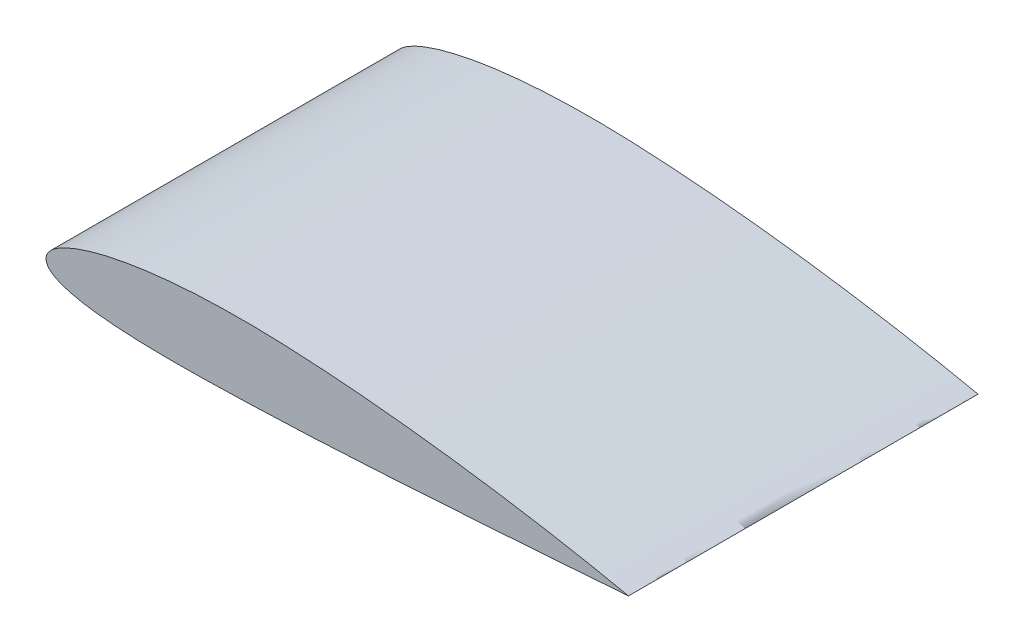
from build123d import *

# Parameters (mm, degrees)
BOSS_EXTRUDE1_DEPTH = 90


with BuildPart() as part:
    # Sketch2 → Boss-Extrude1 (new body)
    with BuildSketch(Plane(origin=(0, 0, 0), x_dir=(0, 1, 0), z_dir=(0, 0, 1))):
        with BuildLine():
            add(Edge.make_bspline(
                [(0, -150), (0.001772852, -150.000113217), (0.014188067, -149.921239361), (0.03587152, -149.840387792), (0.075849773, -149.640781801), (0.129807126, -149.392078651), (0.199990784, -149.060600085), (0.284481374, -148.660424171), (0.384371921, -148.186888977), (0.498346945, -147.642080423), (0.626809917, -147.026096757), (0.768724972, -146.339540429), (0.924267178, -145.583125546), (1.092662171, -144.757444861), (1.273444565, -143.863349902), (1.466386397, -142.901656771), (1.670374758, -141.873202247), (1.885284333, -140.779031297), (2.110311722, -139.620134055), (2.34521269, -138.39763873), (2.588824588, -137.112596551), (2.840744875, -135.766314996), (3.100300174, -134.360029922), (3.366895678, -132.895101478), (3.63983625, -131.37288001), (3.91827985, -129.794898901), (4.201492493, -128.162544552), (4.489134212, -126.47752869), (4.780158908, -124.741283385), (5.074098064, -122.955664154), (5.36989332, -121.122204321), (5.667296066, -119.242834729), (5.965203364, -117.319233153), (6.263182835, -115.353399457), (6.56036872, -113.347150514), (6.856214891, -111.302509581), (7.150030783, -109.221376762), (7.440876589, -107.105819136), (7.728379981, -104.957931758), (8.011628833, -102.779829054), (8.290127231, -100.573637671), (8.563045044, -98.34143452), (8.829802629, -96.085479086), (9.08986205, -93.80803378), (9.342454999, -91.511339391), (9.586687785, -89.197670733), (9.822305905, -86.869265226), (10.048700649, -84.528523414), (10.264722402, -82.177644538), (10.470427233, -79.819143688), (10.664770325, -77.455221836), (10.847506045, -75.088362901), (11.017818629, -72.72084729), (11.174886985, -70.355107061), (11.319083313, -67.993499877), (11.448916979, -65.638411139), (11.564535391, -63.292233708), (11.66525227, -60.953661465), (11.75068009, -58.622476912), (11.814650539, -56.300885149), (11.858188188, -53.994999864), (11.880506673, -51.709753715), (11.881438735, -49.447555115), (11.861470417, -47.210847277), (11.819737421, -45.001943794), (11.757393471, -42.823219287), (11.673434102, -40.676956444), (11.56886006, -38.565475314), (11.443435785, -36.490952243), (11.297958999, -34.455602702), (11.132215188, -32.461570638), (10.947121944, -30.51096561), (10.742902244, -28.605866233), (10.520352219, -26.748238648), (10.279689851, -24.940087067), (10.022072641, -23.18324341), (9.747871209, -21.479559509), (9.458064317, -19.830738565), (9.153109375, -18.238502727), (8.834426873, -16.70442758), (8.502314003, -15.23011759), (8.157716012, -13.81707562), (7.802085538, -12.466550643), (7.43569469, -11.180060595), (7.059725389, -9.958735003), (6.67541441, -8.803659568), (6.28317803, -7.71610078), (5.884300152, -6.696963946), (5.479647201, -5.747125973), (5.069945951, -4.86750545), (4.655965026, -4.058865982), (4.238861232, -3.321737454), (3.819129656, -2.656750919), (3.39725236, -2.064572786), (2.974413291, -1.54506267), (2.550189765, -1.099239069), (2.125512315, -0.726894625), (1.700400264, -0.428312169), (1.274639514, -0.20429923), (0.848305598, -0.055775426), (0.422061314, 0.016965012), (-0.00125861, 0.012395685), (-0.417039198, -0.06700118), (-0.820467851, -0.222253099), (-1.208960569, -0.451454628), (-1.582501067, -0.753369521), (-1.941311496, -1.127058834), (-2.285676058, -1.571888531), (-2.616019232, -2.08712356), (-2.932545803, -2.672281882), (-3.235168404, -3.326822876), (-3.52384516, -4.050082068), (-3.798478139, -4.841356269), (-4.059087056, -5.699779774), (-4.30550558, -6.624541524), (-4.537788915, -7.614591438), (-4.755672317, -8.669015921), (-4.959509975, -9.786599021), (-5.148687378, -10.966376397), (-5.323775577, -12.207009492), (-5.484700178, -13.507339942), (-5.631204432, -14.866053891), (-5.763403573, -16.281848895), (-5.88212349, -17.75322374), (-5.986426819, -19.278875171), (-6.077563242, -20.857272776), (-6.15500988, -22.486975398), (-6.219524657, -24.166404295), (-6.271388474, -25.893919625), (-6.310429841, -27.667983287), (-6.337990562, -29.486926982), (-6.353323897, -31.349070459), (-6.358084197, -33.252651851), (-6.351799823, -35.195978138), (-6.335567352, -37.177247028), (-6.31000242, -39.194714629), (-6.275088, -41.246421322), (-6.23211589, -43.330579556), (-6.181293018, -45.445232945), (-6.123204243, -47.588528145), (-6.058907838, -49.758475533), (-5.988981428, -51.953075147), (-5.913616191, -54.17031133), (-5.834185904, -56.408211273), (-5.750309831, -58.667189551), (-5.664320588, -60.94886622), (-5.570922648, -63.250776633), (-5.470931144, -65.568284783), (-5.364311884, -67.895375012), (-5.252061889, -70.229918442), (-5.134738365, -72.569614371), (-5.012796298, -74.912211039), (-4.88656359, -77.255399057), (-4.75689037, -79.596900587), (-4.623700737, -81.934480598), (-4.488242657, -84.265887735), (-4.350105339, -86.588766246), (-4.21055251, -88.900870126), (-4.069440083, -91.199967465), (-3.926985662, -93.483746103), (-3.784316629, -95.750004892), (-3.64109165, -97.996450779), (-3.497615059, -100.220933318), (-3.354824251, -102.421243985), (-3.212256041, -104.595180001), (-3.070745852, -106.740582819), (-2.930248263, -108.855333226), (-2.790916589, -110.937277965), (-2.653082504, -112.984422441), (-2.517094885, -114.994673387), (-2.383076328, -116.96602908), (-2.250945298, -118.896473704), (-2.121038762, -120.784116446), (-1.993857139, -122.627031687), (-1.868818734, -124.423315244), (-1.746864938, -126.171225555), (-1.627561481, -127.868964875), (-1.511635168, -129.514830792), (-1.398454905, -131.107114587), (-1.288923063, -132.644223097), (-1.182730824, -134.124570194), (-1.08020845, -135.546622318), (-0.981306083, -136.908961335), (-0.886675593, -138.210177451), (-0.795690372, -139.448910329), (-0.709217893, -140.62391607), (-0.627107652, -141.733972855), (-0.549186231, -142.777906469), (-0.476195471, -143.754710808), (-0.408031214, -144.66331768), (-0.344525442, -145.502754855), (-0.286268284, -146.272165579), (-0.232949428, -146.970690992), (-0.185216865, -147.597741081), (-0.142547472, -148.152412316), (-0.105561748, -148.634767327), (-0.074046137, -149.042495806), (-0.048183721, -149.380323549), (-0.027735534, -149.633989172), (-0.014247734, -149.837060335), (-0.003553618, -149.920038893), (-0.001774589, -149.999886672), (0, -150)],
                knots=[0, 0, 0, 0, 0.000122196, 0.000489366, 0.001100825, 0.001955617, 0.003053261, 0.004392394, 0.00597216, 0.007790718, 0.009846052, 0.012135848, 0.014658572, 0.017410957, 0.020390795, 0.023594442, 0.027019508, 0.030661877, 0.034517821, 0.038584192, 0.042856608, 0.047330397, 0.052001374, 0.056865359, 0.061916643, 0.067150976, 0.072562183, 0.078146195, 0.083896287, 0.089807838, 0.095873659, 0.102089223, 0.10844736, 0.114942028, 0.121566636, 0.128315157, 0.135180048, 0.142155718, 0.149234225, 0.156408543, 0.163672206, 0.171017724, 0.178438167, 0.185925639, 0.193472689, 0.201072369, 0.208716388, 0.21639836, 0.224109391, 0.231842732, 0.239590055, 0.247344597, 0.255097583, 0.262842253, 0.270570497, 0.278275047, 0.285947799, 0.293581597, 0.301205, 0.30879937, 0.316332419, 0.323797387, 0.331186574, 0.338492792, 0.345708893, 0.352828692, 0.359844134, 0.36674956, 0.373537902, 0.380203039, 0.386738456, 0.393138527, 0.39939671, 0.405507417, 0.411465631, 0.417265202, 0.422901112, 0.428369272, 0.433664187, 0.438781664, 0.443717374, 0.44846782, 0.453028859, 0.457397402, 0.461570588, 0.465546141, 0.469321358, 0.472894854, 0.476265705, 0.479433597, 0.48239857, 0.485162647, 0.487727713, 0.490098465, 0.492281079, 0.4942841, 0.496120044, 0.497804999, 0.499361515, 0.500817849, 0.502209372, 0.503576005, 0.504942779, 0.506334018, 0.507789351, 0.509343568, 0.511024575, 0.512853072, 0.514845748, 0.517013676, 0.519365207, 0.521905928, 0.52463922, 0.527567761, 0.530692138, 0.534012769, 0.537528408, 0.541238499, 0.545140396, 0.549232452, 0.553511634, 0.557975145, 0.562619171, 0.5674408, 0.572435327, 0.577599139, 0.582928397, 0.588417794, 0.594062898, 0.599858713, 0.605800721, 0.611883327, 0.618100922, 0.624448324, 0.63092032, 0.637510181, 0.644213127, 0.651021867, 0.65793107, 0.664934394, 0.67202545, 0.679197367, 0.686443768, 0.693758214, 0.701133817, 0.708588156, 0.716125565, 0.723702046, 0.731311757, 0.738945825, 0.746597833, 0.754260398, 0.761925155, 0.769585174, 0.777233082, 0.784861419, 0.792462345, 0.80002839, 0.807552199, 0.815026873, 0.822443956, 0.829796607, 0.837077924, 0.844280453, 0.851396374, 0.858419729, 0.865342667, 0.872158315, 0.878860255, 0.88544207, 0.891895908, 0.898216395, 0.904397112, 0.910431152, 0.916312685, 0.922036236, 0.927595454, 0.932984895, 0.938199221, 0.943232954, 0.94808072, 0.952738088, 0.957199651, 0.961461429, 0.965518574, 0.969367071, 0.973003012, 0.976422491, 0.97962198, 0.982598548, 0.985348289, 0.987868686, 0.990157299, 0.992211122, 0.994028729, 0.99560809, 0.996946763, 0.99804475, 0.998899533, 0.999510699, 0.999877684, 1, 1, 1, 1], degree=3))
        make_face()
    extrude(amount=BOSS_EXTRUDE1_DEPTH)


solid = part.part
